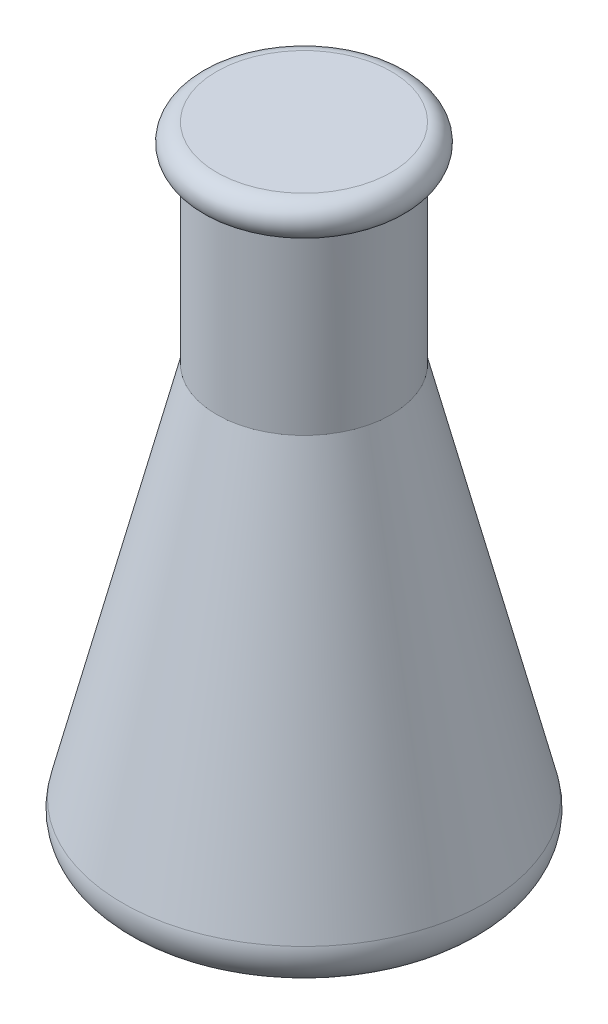
from build123d import *

# Parameters (mm, degrees)
FILLET1_R = 3


with BuildPart() as part:
    # Sketch1 → Revolve1 (revolve)
    with BuildSketch(Plane.XY, mode=Mode.PRIVATE) as revolve1_sk:
        Polygon((7.5, 9), (16.5, -27), (0, -27), (0, 27), (7.5, 27), (7.5, 24), align=None)
        with BuildLine():
            Line((7.5, 27), (7.5, 24))
            ThreePointArc((7.5, 24), (9.01023977, 25.5), (7.5, 27))
        make_face()
    revolve(revolve1_sk.sketch.rotate(Axis((0, 41.422918103, 0), (0, -1, 0)), 180), axis=Axis((0, 41.422918103, 0), (0, -1, 0)))

    # Fillet1
    fillet1_edges = [part.edges().sort_by_distance(p)[0] for p in [
        (16.5, -27, 0),
    ]]
    fillet(fillet1_edges, radius=FILLET1_R)


solid = part.part
